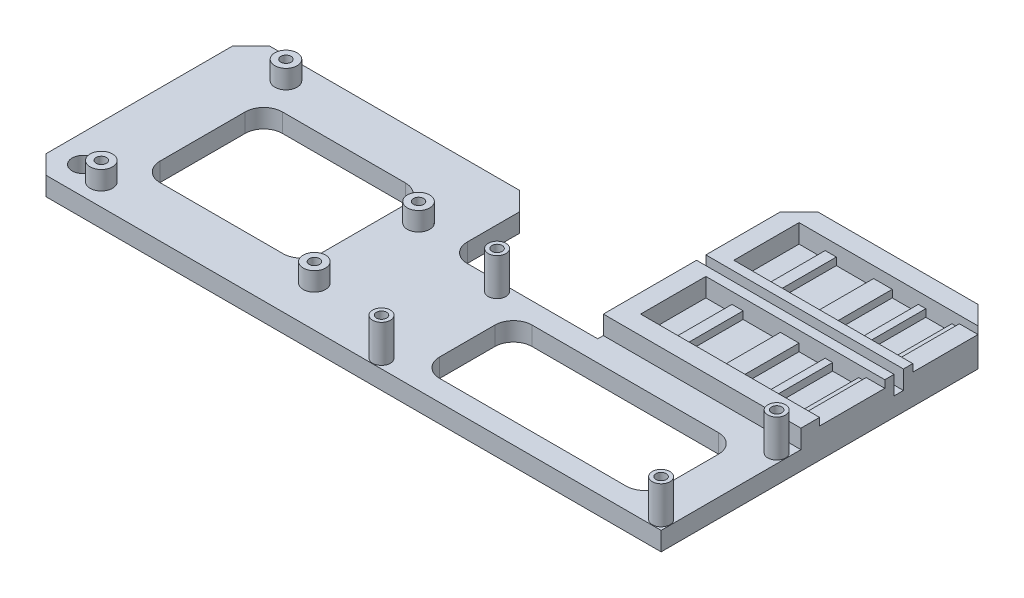
from build123d import *

# Parameters (mm, degrees)
SKETCH1_W                           = 170
SKETCH1_H                           = 60
SKETCH1_W_2                         = 53
SKETCH1_H_2                         = 30
BOSS_EXTRUDE1_DEPTH                 = 5
SKETCH3_W                           = 40
SKETCH3_H                           = 24
CUT_EXTRUDE1_DEPTH                  = 5
SKETCH5_R                           = 3
CUT_EXTRUDE2_DEPTH                  = 10
SKETCH6_R                           = 3
SKETCH6_R_2                         = 1.375
BOSS_EXTRUDE2_DEPTH                 = 5
SKETCH8_R                           = 2.375
SKETCH8_R_2                         = 1.375
BOSS_EXTRUDE3_DEPTH                 = 10
SKETCH9_W                           = 53
SKETCH9_H                           = 25
SKETCH9_W_2                         = 43
SKETCH9_H_2                         = 17.5
BOSS_EXTRUDE4_DEPTH                 = 5
SKETCH10_W                          = 3
SKETCH10_H                          = 17.5
SKETCH10_W_2                        = 5
SKETCH10_W_3                        = 2
BOSS_EXTRUDE5_DEPTH                 = 2
SKETCH11_W                          = 5
SKETCH11_H                          = 17.5
CUT_EXTRUDE5_DEPTH                  = 2
CHAMFER1_SIZE                       = 5
FILLET1_R                           = 5
SKETCH12_W                          = 43
SKETCH12_H                          = 32.847222222
SKETCH12_W_2                        = 60
SKETCH12_H_2                        = 24.8
CUT_EXTRUDE6_DEPTH                  = 105.522724802
FILLET2_R                           = 5
F_2_8_2_8_DIAMETER_HOLE1_AT_2_COUNT = 2
F_2_8_2_8_DIAMETER_HOLE1_AT_2_PITCH = 53.036757065
F_2_8_2_8_DIAMETER_HOLE1_AT_3_COUNT = 2
F_2_8_2_8_DIAMETER_HOLE1_AT_3_PITCH = 79.966896276
F_2_8_2_8_DIAMETER_HOLE1_AT_4_COUNT = 2
F_2_8_2_8_DIAMETER_HOLE1_AT_4_PITCH = 48.276707634
F_2_8_2_8_DIAMETER_HOLE1_AT_5_COUNT = 2
F_2_8_2_8_DIAMETER_HOLE1_AT_5_PITCH = 66.671976122
F_2_8_2_8_DIAMETER_HOLE1_AT_6_COUNT = 2
F_2_8_2_8_DIAMETER_HOLE1_AT_6_PITCH = 92.923433535
F_2_8_2_8_DIAMETER_HOLE1_AT_7_COUNT = 2
F_2_8_2_8_DIAMETER_HOLE1_AT_7_PITCH = 160.77550964
F_2_8_2_8_DIAMETER_HOLE1_AT_8_COUNT = 2
F_2_8_2_8_DIAMETER_HOLE1_AT_8_PITCH = 153.65124308


with BuildPart() as part:
    # Sketch1 → Boss-Extrude1 (new body)
    with BuildSketch(Plane(origin=(0, 0, 0), x_dir=(1, 0, 0), z_dir=(0, 1, 0))):
        Rectangle(SKETCH1_W, SKETCH1_H)
        with Locations((58.5, 45)):
            Rectangle(SKETCH1_W_2, SKETCH1_H_2)
    extrude(amount=BOSS_EXTRUDE1_DEPTH)

    # Sketch3 → Cut-Extrude1 (cut)
    with BuildSketch(Plane(origin=(0, 5, 0), x_dir=(1, 0, 0), z_dir=(0, 1, 0))):
        with Locations((12, 18)):
            Rectangle(SKETCH3_W, SKETCH3_H)
    extrude(amount=-CUT_EXTRUDE1_DEPTH, mode=Mode.SUBTRACT)

    # Sketch5 → Cut-Extrude2 (cut)
    with BuildSketch(Plane.XZ):
        with Locations(Location((-77.5, 22.5, 0), (0, 0, 270))):
            Circle(SKETCH5_R)
    extrude(amount=-CUT_EXTRUDE2_DEPTH, mode=Mode.SUBTRACT)

    # Sketch6 → Boss-Extrude2 (add)
    # profile 1 of 4: a face of its own
    with BuildSketch(Plane(origin=(0, 5, 0), x_dir=(1, 0, 0), z_dir=(0, 1, 0))):
        with Locations(Location((-71.03, -24.13, 0), (0, 0, 270))):
            Circle(SKETCH6_R)
        with Locations(Location((-71.03, -24.13, 0), (0, 0, 270))):
            Circle(SKETCH6_R_2, mode=Mode.SUBTRACT)
    # profile 2 of 4: a face of its own
    with BuildSketch(Plane(origin=(0, 5, 0), x_dir=(1, 0, 0), z_dir=(0, 1, 0))):
        with Locations(Location((-69.76, 24.13, 0), (0, 0, 270))):
            Circle(SKETCH6_R)
        with Locations(Location((-69.76, 24.13, 0), (0, 0, 270))):
            Circle(SKETCH6_R_2, mode=Mode.SUBTRACT)
    # profile 3 of 4: a face of its own
    with BuildSketch(Plane(origin=(0, 5, 0), x_dir=(1, 0, 0), z_dir=(0, 1, 0))):
        with Locations(Location((-18.96, -19.05, 0), (0, 0, 270))):
            Circle(SKETCH6_R)
        with Locations(Location((-18.96, -19.05, 0), (0, 0, 270))):
            Circle(SKETCH6_R_2, mode=Mode.SUBTRACT)
    # profile 4 of 4: a face of its own
    with BuildSketch(Plane(origin=(0, 5, 0), x_dir=(1, 0, 0), z_dir=(0, 1, 0))):
        with Locations(Location((-18.96, 8.89, 0), (0, 0, 270))):
            Circle(SKETCH6_R)
        with Locations(Location((-18.96, 8.89, 0), (0, 0, 270))):
            Circle(SKETCH6_R_2, mode=Mode.SUBTRACT)
    extrude(amount=BOSS_EXTRUDE2_DEPTH)

    # Sketch8 → Boss-Extrude3 (add)
    # profile 1 of 4: a face of its own
    with BuildSketch(Plane(origin=(0, 5, 0), x_dir=(1, 0, 0), z_dir=(0, 1, 0))):
        with Locations(Location((7.5, 3.5, 0), (0, 0, 270))):
            Circle(SKETCH8_R)
        with Locations(Location((7.5, 3.5, 0), (0, 0, 270))):
            Circle(SKETCH8_R_2, mode=Mode.SUBTRACT)
    # profile 2 of 4: a face of its own
    with BuildSketch(Plane(origin=(0, 5, 0), x_dir=(1, 0, 0), z_dir=(0, 1, 0))):
        with Locations(Location((7.5, -27.5, 0), (0, 0, 270))):
            Circle(SKETCH8_R)
        with Locations(Location((7.5, -27.5, 0), (0, 0, 270))):
            Circle(SKETCH8_R_2, mode=Mode.SUBTRACT)
    # profile 3 of 4: a face of its own
    with BuildSketch(Plane(origin=(0, 5, 0), x_dir=(1, 0, 0), z_dir=(0, 1, 0))):
        with Locations(Location((82.5, -27.5, 0), (0, 0, 270))):
            Circle(SKETCH8_R)
        with Locations(Location((82.5, -27.5, 0), (0, 0, 270))):
            Circle(SKETCH8_R_2, mode=Mode.SUBTRACT)
    # profile 4 of 4: a face of its own
    with BuildSketch(Plane(origin=(0, 5, 0), x_dir=(1, 0, 0), z_dir=(0, 1, 0))):
        with Locations(Location((82.5, 3.5, 0), (0, 0, 270))):
            Circle(SKETCH8_R)
        with Locations(Location((82.5, 3.5, 0), (0, 0, 270))):
            Circle(SKETCH8_R_2, mode=Mode.SUBTRACT)
    extrude(amount=BOSS_EXTRUDE3_DEPTH)

    # Sketch9 → Boss-Extrude4 (add)
    # profile 1 of 2: a face of its own
    with BuildSketch(Plane(origin=(0, 5, 0), x_dir=(1, 0, 0), z_dir=(0, 1, 0))):
        with Locations((58.5, 47.5)):
            Rectangle(SKETCH9_W, SKETCH9_H)
        with Locations((58.5, 46.25)):
            Rectangle(SKETCH9_W_2, SKETCH9_H_2, mode=Mode.SUBTRACT)
    # profile 2 of 2: a face of its own
    with BuildSketch(Plane(origin=(0, 5, 0), x_dir=(1, 0, 0), z_dir=(0, 1, 0))):
        with Locations((58.5, 20)):
            Rectangle(SKETCH9_W, SKETCH9_H)
        with Locations((58.5, 21.25)):
            Rectangle(SKETCH9_W_2, SKETCH9_H_2, mode=Mode.SUBTRACT)
    extrude(amount=BOSS_EXTRUDE4_DEPTH)

    # Sketch10 → Boss-Extrude5 (add)
    with BuildSketch(Plane(origin=(0, 5, 0), x_dir=(1, 0, 0), z_dir=(0, 1, 0))):
        with Locations((45.5, 21.25)):
            Rectangle(SKETCH10_W, SKETCH10_H)
        with Locations((59.5, 21.25)):
            Rectangle(SKETCH10_W_2, SKETCH10_H)
        with Locations((70, 21.25)):
            Rectangle(SKETCH10_W_3, SKETCH10_H)
        with Locations((45.5, 46.25)):
            Rectangle(SKETCH10_W, SKETCH10_H)
        with Locations((59.5, 46.25)):
            Rectangle(SKETCH10_W_2, SKETCH10_H)
        with Locations((70, 46.25)):
            Rectangle(SKETCH10_W_3, SKETCH10_H)
        with Locations((79, 21.25)):
            Rectangle(SKETCH10_W_3, SKETCH10_H)
        with Locations((79, 46.25)):
            Rectangle(SKETCH10_W_3, SKETCH10_H)
    extrude(amount=BOSS_EXTRUDE5_DEPTH)

    # Sketch11 → Cut-Extrude5 (cut)
    with BuildSketch(Plane(origin=(0, 10, 0), x_dir=(1, 0, 0), z_dir=(0, 1, 0))):
        with Locations((82.5, 21.25)):
            Rectangle(SKETCH11_W, SKETCH11_H)
        with Locations((82.5, 46.25)):
            Rectangle(SKETCH11_W, SKETCH11_H)
    extrude(amount=-CUT_EXTRUDE5_DEPTH, mode=Mode.SUBTRACT)

    # Chamfer1
    chamfer1_edges = [part.edges().sort_by_distance(p)[0] for p in [
        (-85, 2.5, 30),
        (-85, 2.5, -30),
        (-8, 2.5, -30),
        (32, 5, -60),
        (85, 5, -60),
    ]]
    chamfer(chamfer1_edges, length=CHAMFER1_SIZE)

    # Fillet1
    fillet1_edges = [part.edges().sort_by_distance(p)[0] for p in [
        (-8, 2.5, -6),
    ]]
    fillet(fillet1_edges, radius=FILLET1_R)

    # Sketch12 → Cut-Extrude6 (cut, through all)
    with BuildSketch(Plane(origin=(0, 5, 0), x_dir=(1, 0, 0), z_dir=(0, 1, 0))):
        with Locations((-46.5, 0)):
            Rectangle(SKETCH12_W, SKETCH12_H)
        with Locations((45, -12)):
            Rectangle(SKETCH12_W_2, SKETCH12_H_2)
    extrude(amount=-CUT_EXTRUDE6_DEPTH, mode=Mode.SUBTRACT)

    # Fillet2
    fillet2_edges = [part.edges().sort_by_distance(p)[0] for p in [
        (-25, 2.5, -16.423611111),
        (-25, 2.5, 16.423611111),
        (-68, 2.5, 16.423611111),
        (-68, 2.5, -16.423611111),
        (75, 2.5, -0.4),
        (75, 2.5, 24.4),
        (15, 2.5, 24.4),
        (15, 2.5, -0.4),
    ]]
    fillet(fillet2_edges, radius=FILLET2_R)

    # Sketch14 → Ø2.8 (2.8) Diameter Hole1 (revolve, cut)
    with BuildSketch(Plane(origin=(-69.76, 5, -24.13), x_dir=(0, 0, 1), z_dir=(1, 0, 0))):
        Polygon((0, 0), (0, 10.841204867), (1.4, 10), (1.4, 0), align=None)
    f_2_8_2_8_diameter_hole1 = revolve(axis=Axis((-69.76, 11.35, -24.13), (0, -1, 0)), mode=Mode.SUBTRACT)

    # Ø2.8 (2.8) Diameter Hole1 at 2: Ø2.8 (2.8) Diameter Hole1 ×2
    with Locations(*[Vector(0.9578262852211514, 0, 0.2873478855663455) * (i * F_2_8_2_8_DIAMETER_HOLE1_AT_2_PITCH) for i in range(1, F_2_8_2_8_DIAMETER_HOLE1_AT_2_COUNT)]):
        add(f_2_8_2_8_diameter_hole1, mode=Mode.SUBTRACT)

    # Ø2.8 (2.8) Diameter Hole1 at 3: Ø2.8 (2.8) Diameter Hole1 ×2
    with Locations(*[Vector(0.9661497894509072, 0, 0.2579817519592574) * (i * F_2_8_2_8_DIAMETER_HOLE1_AT_3_PITCH) for i in range(1, F_2_8_2_8_DIAMETER_HOLE1_AT_3_COUNT)]):
        add(f_2_8_2_8_diameter_hole1, mode=Mode.SUBTRACT)

    # Ø2.8 (2.8) Diameter Hole1 at 4: Ø2.8 (2.8) Diameter Hole1 ×2
    with Locations(*[Vector(-0.02630668208823303, 0, 0.9996539193528472) * (i * F_2_8_2_8_DIAMETER_HOLE1_AT_4_PITCH) for i in range(1, F_2_8_2_8_DIAMETER_HOLE1_AT_4_COUNT)]):
        add(f_2_8_2_8_diameter_hole1, mode=Mode.SUBTRACT)

    # Ø2.8 (2.8) Diameter Hole1 at 5: Ø2.8 (2.8) Diameter Hole1 ×2
    with Locations(*[Vector(0.7619393177594593, 0, 0.6476484200955406) * (i * F_2_8_2_8_DIAMETER_HOLE1_AT_5_PITCH) for i in range(1, F_2_8_2_8_DIAMETER_HOLE1_AT_5_COUNT)]):
        add(f_2_8_2_8_diameter_hole1, mode=Mode.SUBTRACT)

    # Ø2.8 (2.8) Diameter Hole1 at 6: Ø2.8 (2.8) Diameter Hole1 ×2
    with Locations(*[Vector(0.8314372065320044, 0, 0.5556187286208567) * (i * F_2_8_2_8_DIAMETER_HOLE1_AT_6_PITCH) for i in range(1, F_2_8_2_8_DIAMETER_HOLE1_AT_6_COUNT)]):
        add(f_2_8_2_8_diameter_hole1, mode=Mode.SUBTRACT)

    # Ø2.8 (2.8) Diameter Hole1 at 7: Ø2.8 (2.8) Diameter Hole1 ×2
    with Locations(*[Vector(0.9470347837238248, 0, 0.3211309988418566) * (i * F_2_8_2_8_DIAMETER_HOLE1_AT_7_PITCH) for i in range(1, F_2_8_2_8_DIAMETER_HOLE1_AT_7_COUNT)]):
        add(f_2_8_2_8_diameter_hole1, mode=Mode.SUBTRACT)

    # Ø2.8 (2.8) Diameter Hole1 at 8: Ø2.8 (2.8) Diameter Hole1 ×2
    with Locations(*[Vector(0.99094544858852, 0, 0.13426510314187035) * (i * F_2_8_2_8_DIAMETER_HOLE1_AT_8_PITCH) for i in range(1, F_2_8_2_8_DIAMETER_HOLE1_AT_8_COUNT)]):
        add(f_2_8_2_8_diameter_hole1, mode=Mode.SUBTRACT)


solid = part.part
